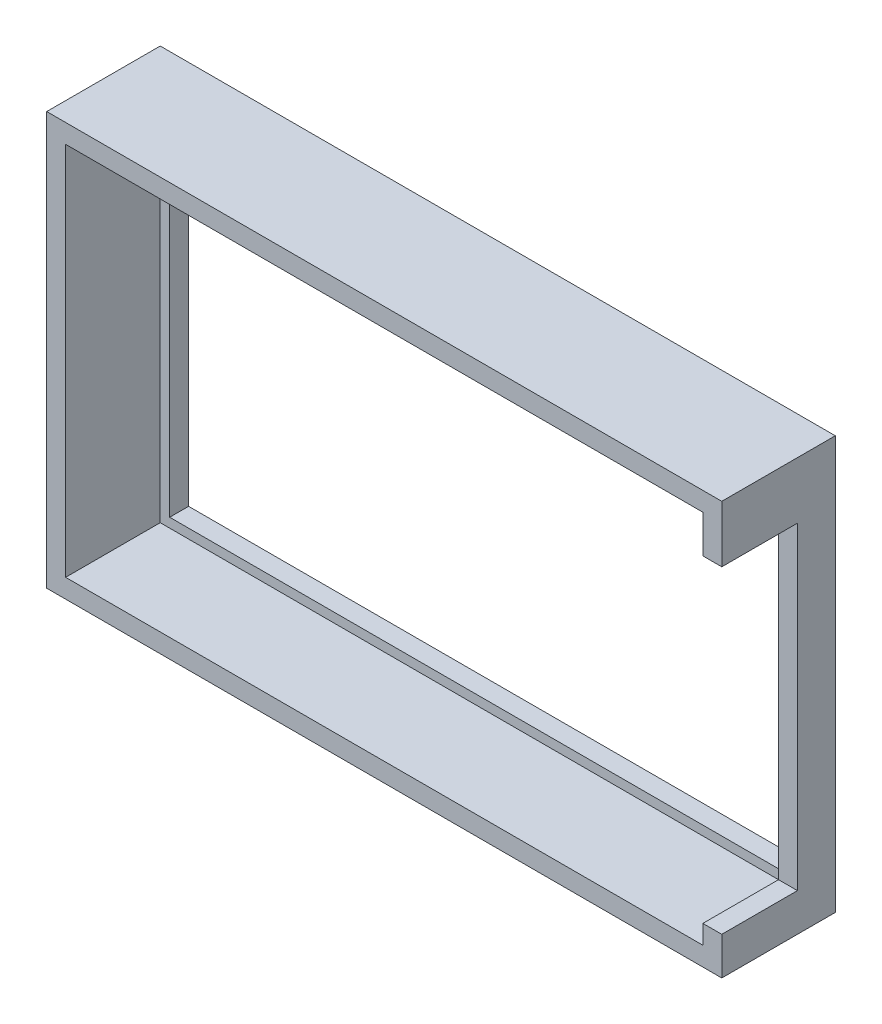
from build123d import *

# Parameters (mm, degrees)
ESQUISSE1_W             = 35.68
ESQUISSE1_H             = 21.82
BOSS_EXTRU_1_DEPTH      = 6
ESQUISSE2_W             = 33.68
ESQUISSE2_H             = 19.82
ENL_V_MAT_EXTRU_1_DEPTH = 5
ESQUISSE3_W             = 32.68
ESQUISSE3_H             = 18.82
ENL_V_MAT_EXTRU_2_DEPTH = 43.120954405
ESQUISSE4_W             = 4
ESQUISSE4_H             = 16.82
ENL_V_MAT_EXTRU_3_DEPTH = 5


with BuildPart() as part:
    # Esquisse1 → Boss.-Extru.1 (new body)
    with BuildSketch(Plane.XY):
        with Locations((17.84, 10.91)):
            Rectangle(ESQUISSE1_W, ESQUISSE1_H)
    extrude(amount=BOSS_EXTRU_1_DEPTH)

    # Esquisse2 → Enlèv. mat.-Extru.1 (cut)
    with BuildSketch(Plane.XY.offset(6)):
        with Locations((17.84, 10.91)):
            Rectangle(ESQUISSE2_W, ESQUISSE2_H)
    extrude(amount=-ENL_V_MAT_EXTRU_1_DEPTH, mode=Mode.SUBTRACT)

    # Esquisse3 → Enlèv. mat.-Extru.2 (cut, through all)
    with BuildSketch(Plane.XY.offset(1)):
        with Locations((17.84, 10.91)):
            Rectangle(ESQUISSE3_W, ESQUISSE3_H)
    extrude(amount=-ENL_V_MAT_EXTRU_2_DEPTH, mode=Mode.SUBTRACT)

    # Esquisse4 → Enlèv. mat.-Extru.3 (cut)
    with BuildSketch(Plane(origin=(35.68, 0, 0), x_dir=(0, 0, -1), z_dir=(1, 0, 0))):
        with Locations((-4, 10.41)):
            Rectangle(ESQUISSE4_W, ESQUISSE4_H)
    extrude(amount=-ENL_V_MAT_EXTRU_3_DEPTH, mode=Mode.SUBTRACT)


solid = part.part
